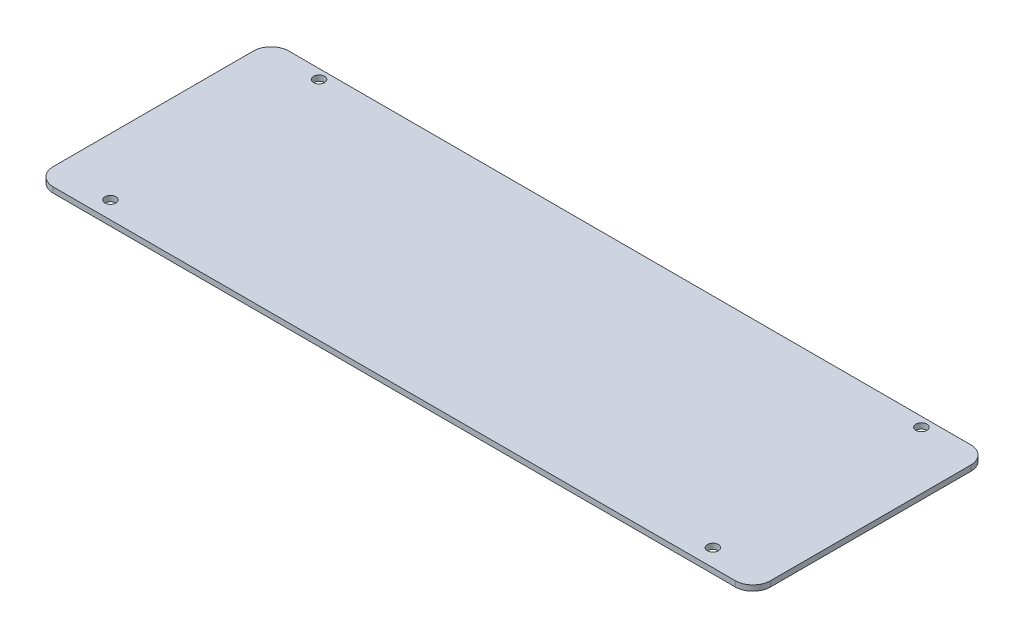
from build123d import *

# Parameters (mm, degrees)
SKETCH1_W           = 414.644000022
SKETCH1_H           = 136.106823022
SKETCH1_R           = 3.175
BOSS_EXTRUDE1_DEPTH = 3.175
FILLET1_R           = 10.16


with BuildPart() as part:
    # Sketch1 → Boss-Extrude1 (new body)
    with BuildSketch(Plane(origin=(0, 0, 0), x_dir=(1, 0, 0), z_dir=(0, 1, 0))):
        with Locations((2.125889647, -60.449047284)):
            Rectangle(SKETCH1_W, SKETCH1_H)
        with Locations(Location((-171.991110353, 2.128477171, 0), (0, 0, 270))):
            Circle(SKETCH1_R, mode=Mode.SUBTRACT)
        with Locations(Location((-171.991110353, -118.449728988, 0), (0, 0, 270))):
            Circle(SKETCH1_R, mode=Mode.SUBTRACT)
        with Locations(Location((176.242889647, 2.128477171, 0), (0, 0, 90))):
            Circle(SKETCH1_R, mode=Mode.SUBTRACT)
        with Locations(Location((176.242889647, -118.449728988, 0), (0, 0, 90))):
            Circle(SKETCH1_R, mode=Mode.SUBTRACT)
    extrude(amount=BOSS_EXTRUDE1_DEPTH)

    # Fillet1
    fillet1_edges = [part.edges().sort_by_distance(p)[0] for p in [
        (-205.196110364, 1.5875, -7.604364227),
        (209.447889658, 1.5875, -7.604364227),
        (209.447889658, 1.5875, 128.502458795),
        (-205.196110364, 1.5875, 128.502458795),
    ]]
    fillet(fillet1_edges, radius=FILLET1_R)


solid = part.part
